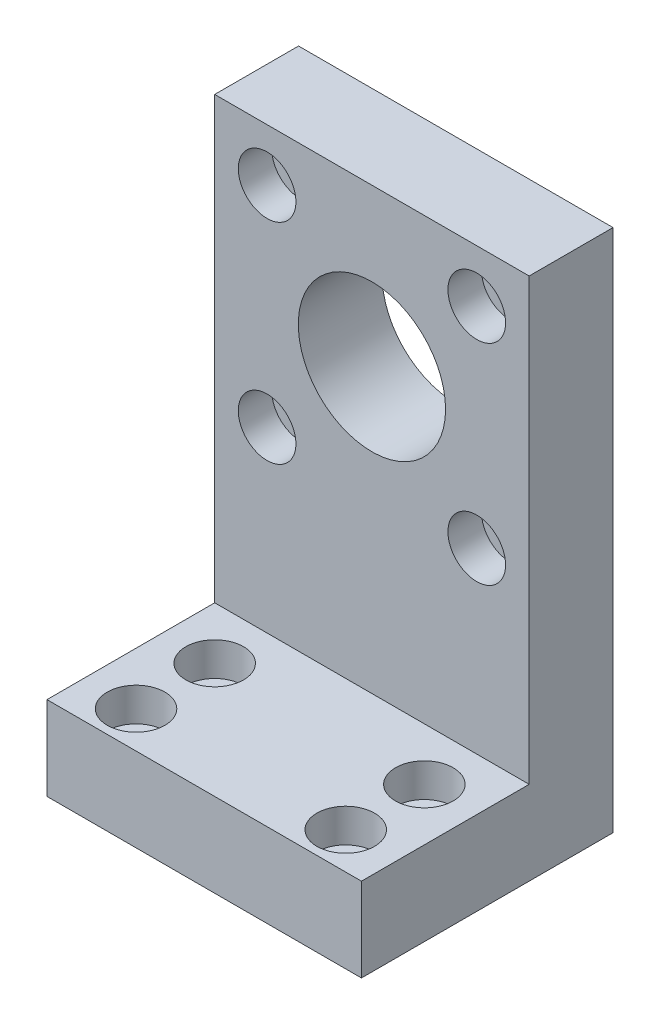
from build123d import *

# Parameters (mm, degrees)
SKETCH1_W                                           = 60
SKETCH1_H                                           = 100
BOSS_EXTRUDE1_DEPTH                                 = 8
CBORE_FOR_M6_HEX_SOCKET_HEAD_CAP_SCREW1_D           = 6.6
CBORE_FOR_M6_HEX_SOCKET_HEAD_CAP_SCREW1_CBORE_D     = 11
CBORE_FOR_M6_HEX_SOCKET_HEAD_CAP_SCREW1_CBORE_DEPTH = 6.4
SKETCH6_R                                           = 14.05
CUT_EXTRUDE1_DEPTH                                  = 61.464865831
SKETCH7_W                                           = 60
SKETCH7_H                                           = 16
BOSS_EXTRUDE2_DEPTH                                 = 32
CBORE_FOR_M6_HEX_SOCKET_HEAD_CAP_SCREW2_D           = 6.6
CBORE_FOR_M6_HEX_SOCKET_HEAD_CAP_SCREW2_CBORE_D     = 11
CBORE_FOR_M6_HEX_SOCKET_HEAD_CAP_SCREW2_CBORE_DEPTH = 6.4


with BuildPart() as part:
    # Sketch1 → Boss-Extrude1 (new, symmetric)
    with BuildSketch(Plane.XY):
        Rectangle(SKETCH1_W, SKETCH1_H)
    extrude(amount=BOSS_EXTRUDE1_DEPTH, both=True)

    # CBORE for M6 Hex Socket Head Cap Screw1 (through all)
    with Locations(Plane.XY.offset(8)):
        with Locations((-20, 40), (20, 40), (20, 0), (-20, 0)):
            CounterBoreHole(CBORE_FOR_M6_HEX_SOCKET_HEAD_CAP_SCREW1_D / 2, CBORE_FOR_M6_HEX_SOCKET_HEAD_CAP_SCREW1_CBORE_D / 2, CBORE_FOR_M6_HEX_SOCKET_HEAD_CAP_SCREW1_CBORE_DEPTH)

    # Sketch6 → Cut-Extrude1 (cut, through all)
    with BuildSketch(Plane.XY.offset(8)):
        with Locations((0, 20)):
            Circle(SKETCH6_R)
    extrude(amount=-CUT_EXTRUDE1_DEPTH, mode=Mode.SUBTRACT)

    # Sketch7 → Boss-Extrude2 (add)
    with BuildSketch(Plane.XY.offset(8)):
        with Locations((0, -42)):
            Rectangle(SKETCH7_W, SKETCH7_H)
    extrude(amount=BOSS_EXTRUDE2_DEPTH)

    # CBORE for M6 Hex Socket Head Cap Screw2 (through all)
    with Locations(Plane(origin=(0, -34, 0), x_dir=(1, 0, 0), z_dir=(0, 1, 0))):
        with Locations((-20, -18), (20, -18), (20, -33), (-20, -33)):
            CounterBoreHole(CBORE_FOR_M6_HEX_SOCKET_HEAD_CAP_SCREW2_D / 2, CBORE_FOR_M6_HEX_SOCKET_HEAD_CAP_SCREW2_CBORE_D / 2, CBORE_FOR_M6_HEX_SOCKET_HEAD_CAP_SCREW2_CBORE_DEPTH)


solid = part.part
